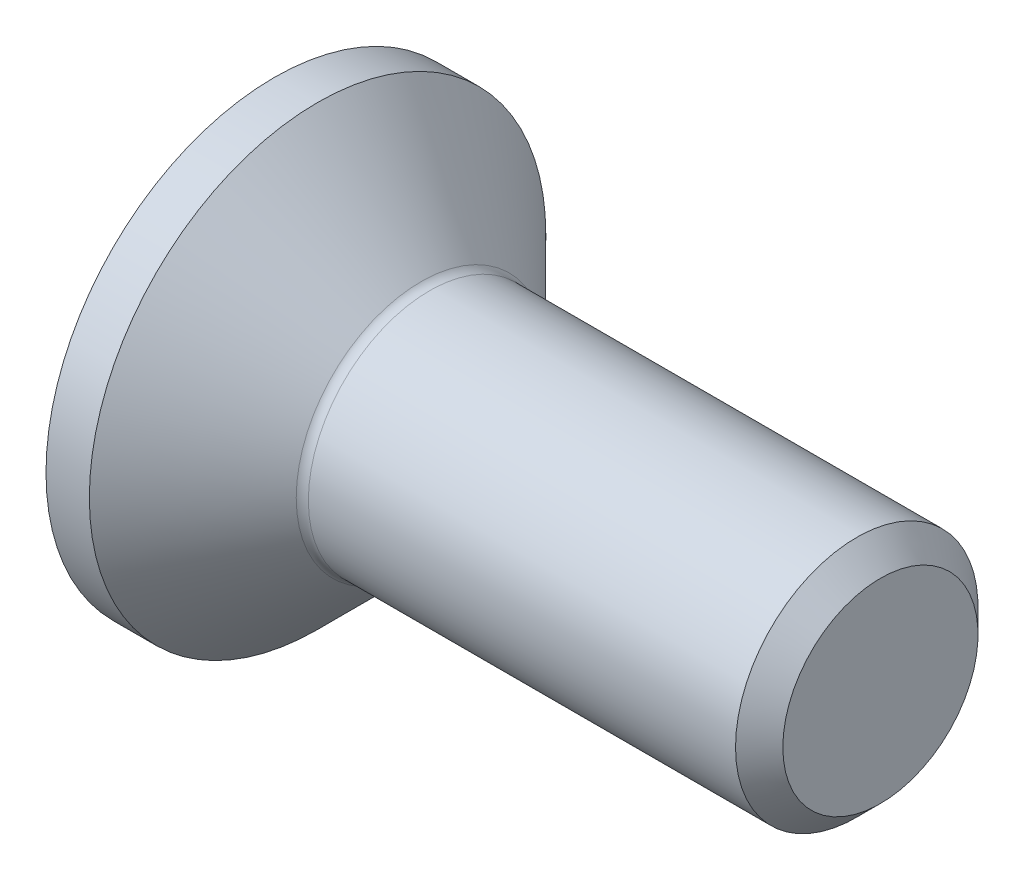
from build123d import *

# Parameters (mm, degrees)
FILLET1_R   = 0.2
HEX_2_DEPTH = 1.5


with BuildPart() as part:
    # BodySke → BaseBody (revolve)
    with BuildSketch(Plane.XY, mode=Mode.PRIVATE) as basebody_sk:
        Polygon((0, 0), (0, 3.765), (0.715, 3.765), (2.48, 2), (9.61, 2), (10, 1.61), (10, 0), align=None)
    revolve(basebody_sk.sketch.rotate(Axis((0, 0, 0), (1, 0, 0)), 90), axis=Axis((0, 0, 0), (1, 0, 0)))

    # Fillet1
    fillet1_edges = [part.edges().sort_by_distance(p)[0] for p in [
        (2.48, 0, -2),
    ]]
    fillet(fillet1_edges, radius=FILLET1_R)

    # Sketch2 → PreBroach (revolve, cut)
    with BuildSketch(Plane.XY, mode=Mode.PRIVATE) as prebroach_sk:
        Polygon((0, 1.25), (1.5, 1.25), (2.221687836, 0), (0, 0), align=None)
    revolve(prebroach_sk.sketch.rotate(Axis((0, 0, 0), (1, 0, 0)), 90), axis=Axis((0, 0, 0), (1, 0, 0)), mode=Mode.SUBTRACT)

    # Sketch3 → Hex 2 (cut)
    with BuildSketch(Plane.ZY):
        Polygon((-1.25, -0.721687836), (-1.25, 0.721687836), (0, 1.443375673), (1.25, 0.721687836), (1.25, -0.721687836), (0, -1.443375673), align=None)
    extrude(amount=-HEX_2_DEPTH, mode=Mode.SUBTRACT)


solid = part.part
